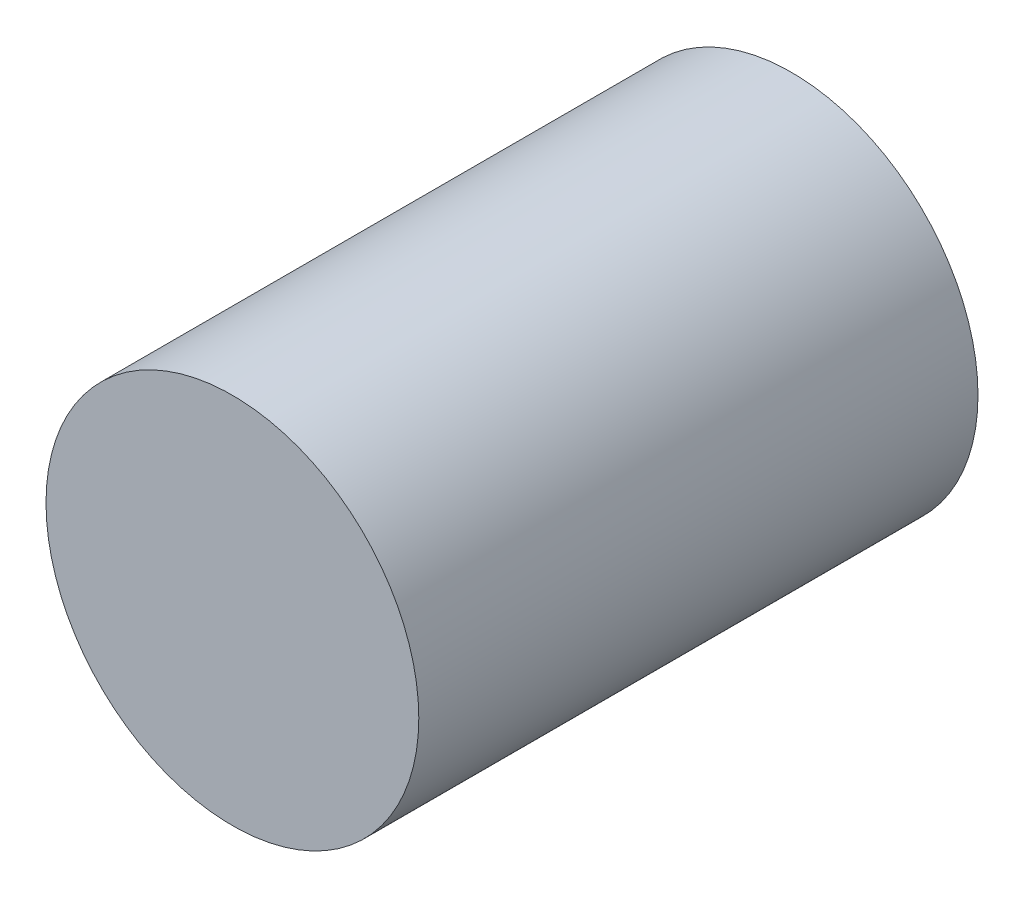
from build123d import *

# Parameters (mm, degrees)
CROQUIS1_R              = 10
SALIENTE_EXTRUIR1_DEPTH = 30


with BuildPart() as part:
    # Croquis1 → Saliente-Extruir1 (new body)
    with BuildSketch(Plane.XY):
        Circle(CROQUIS1_R)
    extrude(amount=SALIENTE_EXTRUIR1_DEPTH)


solid = part.part
